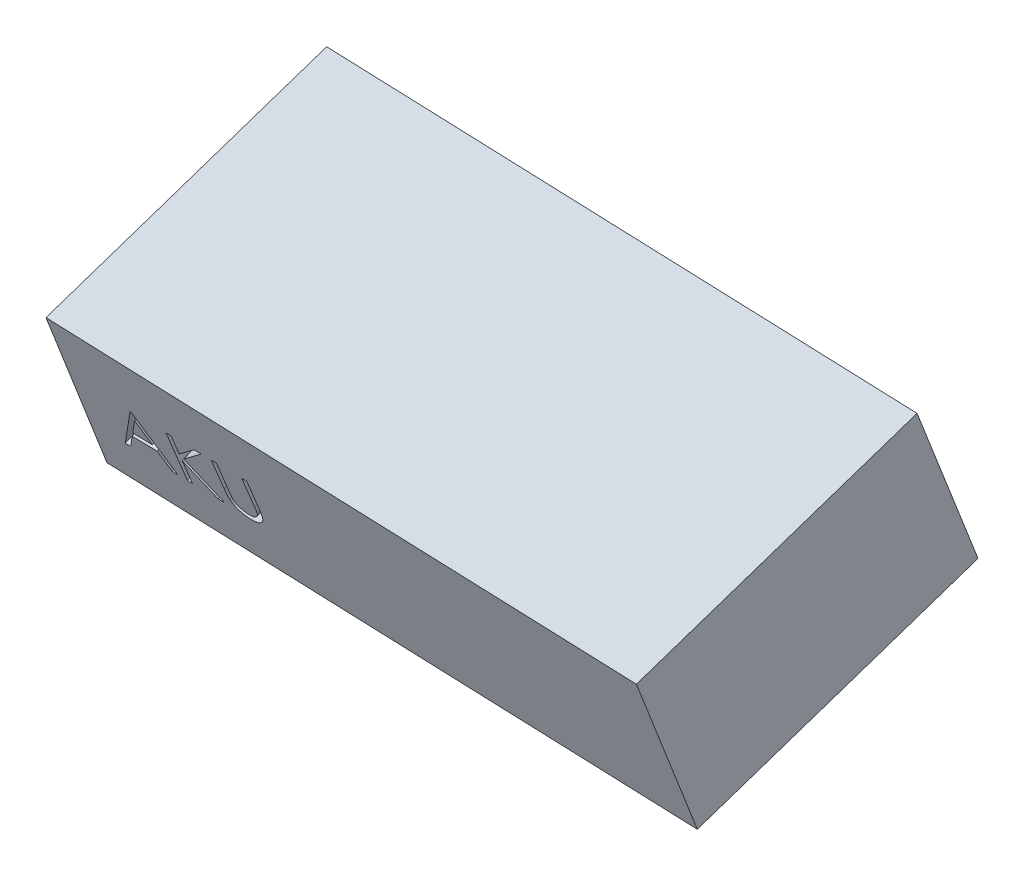
from build123d import *

# Parameters (mm, degrees)
DODANIE_WYCI_GNI_CIE2_DEPTH = 11
WYTNIJ_WYCI_GNI_CIE3_DEPTH  = 3
WYTNIJ_WYCI_GNI_CIE4_DEPTH  = 3


with BuildPart() as part:
    # Szkic1 → Dodanie-wyciągnięcie2 (new body)
    with BuildSketch(Plane(origin=(1.47921456, 39.151475212, 16.187224121), x_dir=(-0.9980302673922155, 0.05213438227806794, -0.0348940045495967), z_dir=(0.034894004549596715, 0.9235656480538229, 0.38184931868659255))):
        Polygon((142.19122447, 20.55396451), (179.164844569, 21.950895709), (179.164844569, 39.963738331), (142.19122447, 38.566807132), align=None)
    extrude(amount=DODANIE_WYCI_GNI_CIE2_DEPTH)

    # Szkic4 → Wytnij-wyciągnięcie3 (cut)
    # profile 1 of 3: a face of its own
    with BuildSketch(Plane(origin=(-0.478214239, -12.657252999, 30.657356989), x_dir=(0.9998960742426839, -0.005501646983603709, 0.01332563674039958), z_dir=(-0.014416681798156014, -0.38157707146439723, 0.9242245927363031))):
        Polygon((-174.893015132, 55.259734902), (-173.277630517, 51.759734902), (-173.619076831, 51.759734902), (-174.136504715, 52.881529774), (-175.723143337, 52.881529774), (-176.25529478, 51.759734902), (-176.598143337, 51.759734902), (-174.937886927, 55.259734902), align=None)
        Polygon((-174.918956639, 54.577543396), (-175.552770741, 53.240504133), (-174.301969459, 53.240504133), align=None, mode=Mode.SUBTRACT)
    # profile 2 of 3: a face of its own
    with BuildSketch(Plane(origin=(-0.478214239, -12.657252999, 30.657356989), x_dir=(0.9998960742426839, -0.005501646983603709, 0.01332563674039958), z_dir=(-0.014416681798156014, -0.38157707146439723, 0.9242245927363031))):
        Polygon((-172.649425389, 55.259734902), (-172.335322824, 55.259734902), (-172.335322824, 53.92690237), (-170.876288369, 55.259734902), (-170.428271542, 55.259734902), (-172.148123305, 53.689222082), (-170.293656158, 51.759734902), (-170.712225869, 51.759734902), (-172.335322824, 53.448737306), (-172.335322824, 51.759734902), (-172.649425389, 51.759734902), align=None)
    # profile 3 of 3: a face of its own
    with BuildSketch(Plane(origin=(-0.478214239, -12.657252999, 30.657356989), x_dir=(0.9998960742426839, -0.005501646983603709, 0.01332563674039958), z_dir=(-0.014416681798156014, -0.38157707146439723, 0.9242245927363031))):
        with BuildLine():
            Line((-169.777630517, 55.259734902), (-169.463527953, 55.259734902))
            Line((-169.463527953, 55.259734902), (-169.463527953, 53.162679614))
            add(Edge.make_bspline(
                [(-169.463527953, 53.162679614), (-169.463574697, 53.132998878), (-169.463663401, 53.076674567), (-169.463070887, 52.996506267), (-169.461411519, 52.925233808), (-169.46036536, 52.86258246), (-169.458038026, 52.808839713), (-169.456139979, 52.763714402), (-169.453699422, 52.7274202), (-169.450766305, 52.706239273), (-169.449505517, 52.697134742)],
                knots=[0, 0, 0, 0, 1.528628734, 2.90083645, 4.128790002, 5.200304208, 6.127813768, 6.898992206, 7.526736466, 8, 8, 8, 8], degree=3))
            add(Edge.make_bspline(
                [(-169.449505517, 52.697134742), (-169.444328058, 52.664287979), (-169.434264872, 52.60044525), (-169.408618494, 52.509536968), (-169.372800993, 52.42760551), (-169.33035795, 52.352094218), (-169.274425339, 52.285104858), (-169.207421803, 52.223393206), (-169.126244035, 52.169421401), (-169.035983429, 52.120070589), (-168.938698192, 52.080405507), (-168.839286925, 52.050412142), (-168.739243946, 52.032133243), (-168.672267781, 52.030016704), (-168.639008722, 52.028965672)],
                knots=[0, 0, 0, 0, 1.035780045, 2.013197591, 2.933192213, 3.817615948, 4.702609284, 5.640816605, 6.646850145, 7.73207398, 8.84249596, 9.914020372, 10.964143139, 12, 12, 12, 12], degree=3))
            add(Edge.make_bspline(
                [(-168.639008722, 52.028965672), (-168.610454981, 52.030039522), (-168.55351242, 52.03218102), (-168.468905989, 52.045442451), (-168.38650588, 52.069343017), (-168.3059052, 52.100182775), (-168.230354216, 52.140930366), (-168.159810774, 52.188001206), (-168.09684684, 52.243212082), (-168.039388842, 52.304312426), (-167.989353906, 52.373252226), (-167.945982764, 52.448530364), (-167.910456835, 52.531279711), (-167.89291331, 52.589434134), (-167.883900549, 52.619310223)],
                knots=[0, 0, 0, 0, 0.994687771, 1.983630487, 2.973142513, 3.978332533, 4.983357753, 5.956394766, 6.925816176, 7.893390482, 8.871859704, 9.88551698, 10.913711441, 12, 12, 12, 12], degree=3))
            add(Edge.make_bspline(
                [(-167.883900549, 52.619310223), (-167.880900423, 52.631658797), (-167.874214935, 52.659176397), (-167.86796789, 52.705697688), (-167.861461365, 52.760587052), (-167.856946795, 52.824238865), (-167.852545574, 52.896439837), (-167.849912502, 52.977566095), (-167.848695469, 53.067323056), (-167.848332788, 53.129960217), (-167.848143337, 53.162679614)],
                knots=[0, 0, 0, 0, 0.558680831, 1.244966039, 2.062412453, 2.990489873, 4.051219941, 5.244515665, 6.560634259, 8, 8, 8, 8], degree=3))
            Line((-167.848143337, 53.162679614), (-167.848143337, 55.259734902))
            Line((-167.848143337, 55.259734902), (-167.534040773, 55.259734902))
            Line((-167.534040773, 55.259734902), (-167.534040773, 53.145852691))
            add(Edge.make_bspline(
                [(-167.534040773, 53.145852691), (-167.534294894, 53.107754312), (-167.534790825, 53.033403009), (-167.539091401, 52.92445165), (-167.545948401, 52.821098669), (-167.555636489, 52.723330172), (-167.568473492, 52.631496013), (-167.582748713, 52.544791245), (-167.600928246, 52.463838252), (-167.622161647, 52.388005834), (-167.646435195, 52.315820321), (-167.677876344, 52.247311706), (-167.713300843, 52.180397307), (-167.755315496, 52.116089198), (-167.802526879, 52.054102645), (-167.85597856, 51.99481357), (-167.913902721, 51.937274523), (-167.97726228, 51.882961457), (-168.045012806, 51.83315278), (-168.116952763, 51.789355009), (-168.192529533, 51.752331392), (-168.271546659, 51.721855467), (-168.354037862, 51.698940868), (-168.440005222, 51.681865712), (-168.529644415, 51.672163415), (-168.590609071, 51.670721485), (-168.621480677, 51.669991313)],
                knots=[0, 0, 0, 0, 1.316592851, 2.569410997, 3.76748051, 4.895814652, 5.963796859, 6.97159953, 7.931736103, 8.829262218, 9.692595152, 10.560224239, 11.431080259, 12.30701507, 13.211635791, 14.121146779, 15.063487852, 16.031507147, 17.00238618, 17.966455255, 18.938106653, 19.907068911, 20.888905087, 21.893141452, 22.933117798, 24, 24, 24, 24], degree=3))
            add(Edge.make_bspline(
                [(-168.621480677, 51.669991313), (-168.65514978, 51.670776078), (-168.721208438, 51.672315785), (-168.818546506, 51.681138535), (-168.911860702, 51.697756929), (-169.002136579, 51.718916873), (-169.088145076, 51.74810061), (-169.171038521, 51.782198735), (-169.249397202, 51.824075995), (-169.32449233, 51.870669388), (-169.394317086, 51.923094026), (-169.45841449, 51.9802342), (-169.51689036, 52.041174578), (-169.568759057, 52.106574943), (-169.614879941, 52.17592665), (-169.654610155, 52.24942589), (-169.688723399, 52.327044206), (-169.706329966, 52.380997407), (-169.715230677, 52.408272563)],
                knots=[0, 0, 0, 0, 1.13879206, 2.234305948, 3.301075583, 4.341971843, 5.366689343, 6.369221514, 7.369726634, 8.367512178, 9.355451585, 10.318319045, 11.268648973, 12.207971039, 13.137398894, 14.081662264, 15.030215811, 16, 16, 16, 16], degree=3))
            add(Edge.make_bspline(
                [(-169.715230677, 52.408272563), (-169.720407835, 52.426905137), (-169.731637207, 52.467319606), (-169.743662504, 52.534206095), (-169.753771586, 52.611221012), (-169.763277144, 52.698369631), (-169.768886102, 52.795719497), (-169.773803541, 52.903228413), (-169.777665159, 53.021026375), (-169.777642387, 53.10308089), (-169.777630517, 53.145852691)],
                knots=[0, 0, 0, 0, 0.625038921, 1.35572334, 2.194682327, 3.136881307, 4.189498639, 5.346923369, 6.617055217, 8, 8, 8, 8], degree=3))
            Line((-169.777630517, 53.145852691), (-169.777630517, 55.259734902))
        make_face()
    extrude(amount=-WYTNIJ_WYCI_GNI_CIE3_DEPTH, mode=Mode.SUBTRACT)

    # Szkic5 → Wytnij-wyciągnięcie4 (cut)
    # profile 1 of 3: a face of its own
    with BuildSketch(Plane(origin=(-0.218713967, -5.788865713, 14.021314319), x_dir=(-0.9998960742426839, 0.005501646983604155, -0.01332563674040067), z_dir=(0.01441668179815719, 0.381577071464397, -0.924224592736303))):
        Polygon((166.431918637, 56.174885813), (168.047303253, 52.674885813), (167.705856938, 52.674885813), (167.188429054, 53.796680685), (165.601790432, 53.796680685), (165.06963899, 52.674885813), (164.726790432, 52.674885813), (166.387046842, 56.174885813), align=None)
        Polygon((166.405977131, 55.492694307), (165.772163028, 54.155655044), (167.02296431, 54.155655044), align=None, mode=Mode.SUBTRACT)
    # profile 2 of 3: a face of its own
    with BuildSketch(Plane(origin=(-0.218713967, -5.788865713, 14.021314319), x_dir=(-0.9998960742426839, 0.005501646983604155, -0.01332563674040067), z_dir=(0.01441668179815719, 0.381577071464397, -0.924224592736303))):
        Polygon((168.675508381, 56.174885813), (168.989610945, 56.174885813), (168.989610945, 54.842053281), (170.4486454, 56.174885813), (170.896662227, 56.174885813), (169.176810464, 54.604372993), (171.031277612, 52.674885813), (170.6127079, 52.674885813), (168.989610945, 54.363888217), (168.989610945, 52.674885813), (168.675508381, 52.674885813), align=None)
    # profile 3 of 3: a face of its own
    with BuildSketch(Plane(origin=(-0.218713967, -5.788865713, 14.021314319), x_dir=(-0.9998960742426839, 0.005501646983604155, -0.01332563674040067), z_dir=(0.01441668179815719, 0.381577071464397, -0.924224592736303))):
        with BuildLine():
            Line((171.547303253, 56.174885813), (171.861405817, 56.174885813))
            Line((171.861405817, 56.174885813), (171.861405817, 54.077830525))
            add(Edge.make_bspline(
                [(171.861405817, 54.077830525), (171.861359073, 54.048149789), (171.861270368, 53.991825478), (171.861862882, 53.911657178), (171.86352225, 53.840384719), (171.86456841, 53.777733371), (171.866895743, 53.723990624), (171.86879379, 53.678865313), (171.871234347, 53.64257111), (171.874167464, 53.621390184), (171.875428253, 53.612285653)],
                knots=[0, 0, 0, 0, 1.528628734, 2.90083645, 4.128790002, 5.200304208, 6.127813768, 6.898992206, 7.526736466, 8, 8, 8, 8], degree=3))
            add(Edge.make_bspline(
                [(171.875428253, 53.612285653), (171.880605711, 53.57943889), (171.890668898, 53.515596161), (171.916315276, 53.424687879), (171.952132777, 53.34275642), (171.994575819, 53.267245129), (172.050508431, 53.200255769), (172.117511966, 53.138544116), (172.198689734, 53.084572312), (172.28895034, 53.0352215), (172.386235578, 52.995556418), (172.485646844, 52.965563053), (172.585689823, 52.947284154), (172.652665988, 52.945167615), (172.685925047, 52.944116583)],
                knots=[0, 0, 0, 0, 1.035780045, 2.013197591, 2.933192213, 3.817615948, 4.702609284, 5.640816605, 6.646850145, 7.73207398, 8.84249596, 9.914020372, 10.964143139, 12, 12, 12, 12], degree=3))
            add(Edge.make_bspline(
                [(172.685925047, 52.944116583), (172.714478788, 52.945190433), (172.77142135, 52.947331931), (172.85602778, 52.960593362), (172.938427889, 52.984493928), (173.019028569, 53.015333686), (173.094579553, 53.056081277), (173.165122995, 53.103152117), (173.22808693, 53.158362993), (173.285544927, 53.219463337), (173.335579863, 53.288403137), (173.378951005, 53.363681275), (173.414476935, 53.446430622), (173.432020459, 53.504585044), (173.441033221, 53.534461134)],
                knots=[0, 0, 0, 0, 0.994687771, 1.983630487, 2.973142513, 3.978332533, 4.983357753, 5.956394766, 6.925816176, 7.893390482, 8.871859704, 9.88551698, 10.913711441, 12, 12, 12, 12], degree=3))
            add(Edge.make_bspline(
                [(173.441033221, 53.534461134), (173.444033346, 53.546809708), (173.450718834, 53.574327308), (173.456965879, 53.620848599), (173.463472404, 53.675737963), (173.467986974, 53.739389776), (173.472388195, 53.811590748), (173.475021268, 53.892717006), (173.476238301, 53.982473966), (173.476600981, 54.045111128), (173.476790432, 54.077830525)],
                knots=[0, 0, 0, 0, 0.558680831, 1.244966039, 2.062412453, 2.990489873, 4.051219941, 5.244515665, 6.560634259, 8, 8, 8, 8], degree=3))
            Line((173.476790432, 54.077830525), (173.476790432, 56.174885813))
            Line((173.476790432, 56.174885813), (173.790892996, 56.174885813))
            Line((173.790892996, 56.174885813), (173.790892996, 54.061003602))
            add(Edge.make_bspline(
                [(173.790892996, 54.061003602), (173.790638876, 54.022905223), (173.790142944, 53.94855392), (173.785842368, 53.839602561), (173.778985368, 53.73624958), (173.76929728, 53.638481083), (173.756460277, 53.546646924), (173.742185056, 53.459942156), (173.724005523, 53.378989163), (173.702772122, 53.303156745), (173.678498574, 53.230971232), (173.647057426, 53.162462617), (173.611632926, 53.095548218), (173.569618273, 53.031240109), (173.52240689, 52.969253556), (173.46895521, 52.909964481), (173.411031049, 52.852425434), (173.347671489, 52.798112368), (173.279920964, 52.748303691), (173.207981006, 52.70450592), (173.132404236, 52.667482303), (173.05338711, 52.637006378), (172.970895907, 52.614091779), (172.884928548, 52.597016623), (172.795289354, 52.587314326), (172.734324698, 52.585872396), (172.703453092, 52.585142224)],
                knots=[0, 0, 0, 0, 1.316592851, 2.569410997, 3.76748051, 4.895814652, 5.963796859, 6.97159953, 7.931736103, 8.829262218, 9.692595152, 10.560224239, 11.431080259, 12.30701507, 13.211635791, 14.121146779, 15.063487852, 16.031507147, 17.00238618, 17.966455255, 18.938106653, 19.907068911, 20.888905087, 21.893141452, 22.933117798, 24, 24, 24, 24], degree=3))
            add(Edge.make_bspline(
                [(172.703453092, 52.585142224), (172.66978399, 52.585926989), (172.603725331, 52.587466695), (172.506387264, 52.596289446), (172.413073067, 52.61290784), (172.32279719, 52.634067784), (172.236788693, 52.663251521), (172.153895249, 52.697349646), (172.075536568, 52.739226906), (172.000441439, 52.785820299), (171.930616683, 52.838244937), (171.86651928, 52.895385111), (171.808043409, 52.956325489), (171.756174713, 53.021725854), (171.710053828, 53.091077561), (171.670323615, 53.164576801), (171.636210371, 53.242195117), (171.618603804, 53.296148318), (171.609703092, 53.323423474)],
                knots=[0, 0, 0, 0, 1.13879206, 2.234305948, 3.301075583, 4.341971843, 5.366689343, 6.369221514, 7.369726634, 8.367512178, 9.355451585, 10.318319045, 11.268648973, 12.207971039, 13.137398894, 14.081662264, 15.030215811, 16, 16, 16, 16], degree=3))
            add(Edge.make_bspline(
                [(171.609703092, 53.323423474), (171.604525934, 53.342056048), (171.593296563, 53.382470517), (171.581271265, 53.449357005), (171.571162184, 53.526371923), (171.561656625, 53.613520542), (171.556047667, 53.710870408), (171.551130229, 53.818379324), (171.54726861, 53.936177286), (171.547291382, 54.018231801), (171.547303253, 54.061003602)],
                knots=[0, 0, 0, 0, 0.625038921, 1.35572334, 2.194682327, 3.136881307, 4.189498639, 5.346923369, 6.617055217, 8, 8, 8, 8], degree=3))
            Line((171.547303253, 54.061003602), (171.547303253, 56.174885813))
        make_face()
    extrude(amount=-WYTNIJ_WYCI_GNI_CIE4_DEPTH, mode=Mode.SUBTRACT)


solid = part.part
